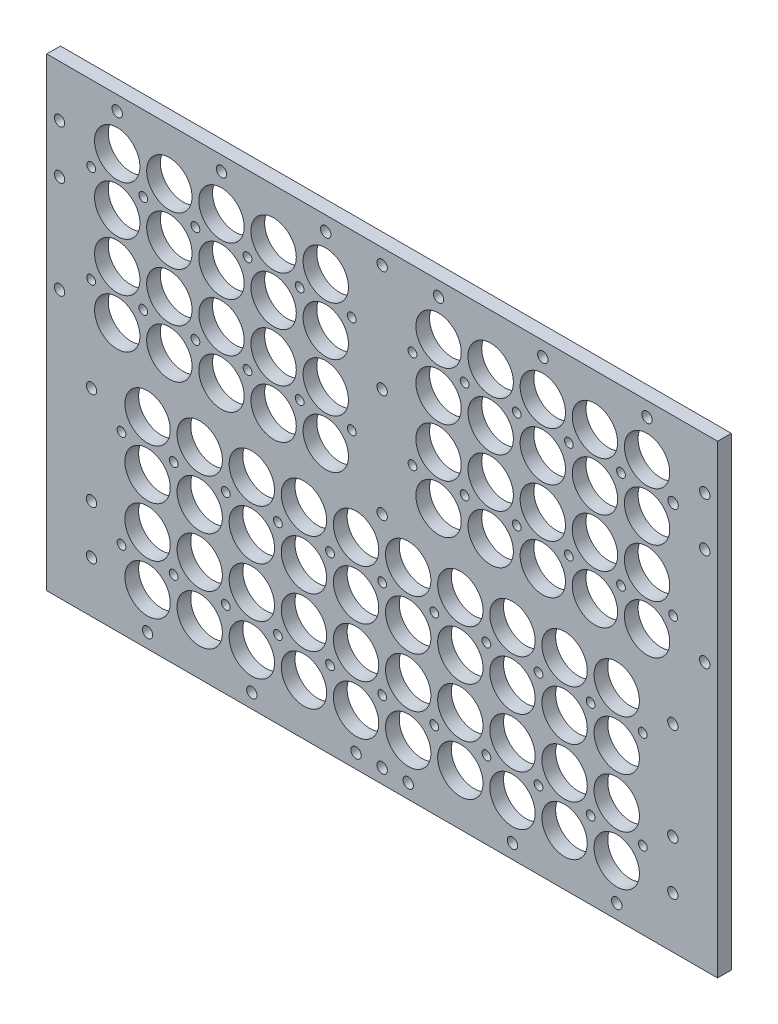
from build123d import *

# Parameters (mm, degrees)
SKETCH1_W            = 310.536510358
SKETCH1_H            = 215.178830534
SKETCH1_R            = 10.5
SKETCH1_R_2          = 10.499999955
SKETCH1_R_3          = 2.032
SKETCH1_R_4          = 1.47134792
SKETCH1_R_5          = 0.465963602
SKETCH1_R_6          = 1.12274205
SKETCH1_R_7          = 2.23196776
SKETCH1_R_8          = 1.6159218
SKETCH1_R_9          = 0.958347744
SKETCH1_R_10         = 1.565
BOSS_EXTRUDE1_DEPTH  = 6.35
M4_CLEARANCE_HOLE1_D = 4.8


with BuildPart() as part:
    # Sketch1 → Boss-Extrude1 (new body)
    with BuildSketch(Plane.XY):
        with Locations((108.585, 83.881415267)):
            Rectangle(SKETCH1_W, SKETCH1_H)
        Circle(SKETCH1_R, mode=Mode.SUBTRACT)
        with Locations((24.13, 0)):
            Circle(SKETCH1_R, mode=Mode.SUBTRACT)
        with Locations((0, 23.097612903)):
            Circle(SKETCH1_R, mode=Mode.SUBTRACT)
        with Locations((24.13, 23.097612903)):
            Circle(SKETCH1_R, mode=Mode.SUBTRACT)
        with Locations((0, 46.195225806)):
            Circle(SKETCH1_R, mode=Mode.SUBTRACT)
        with Locations((24.13, 46.195225806)):
            Circle(SKETCH1_R, mode=Mode.SUBTRACT)
        with Locations((0, 69.29283871)):
            Circle(SKETCH1_R, mode=Mode.SUBTRACT)
        with Locations((24.13, 69.29283871)):
            Circle(SKETCH1_R, mode=Mode.SUBTRACT)
        with Locations((48.26, 0)):
            Circle(SKETCH1_R, mode=Mode.SUBTRACT)
        with Locations((72.39, 0)):
            Circle(SKETCH1_R, mode=Mode.SUBTRACT)
        with Locations((96.52, 0)):
            Circle(SKETCH1_R, mode=Mode.SUBTRACT)
        with Locations((120.65, 0)):
            Circle(SKETCH1_R, mode=Mode.SUBTRACT)
        with Locations((144.78, 0)):
            Circle(SKETCH1_R, mode=Mode.SUBTRACT)
        with Locations((168.91, 0)):
            Circle(SKETCH1_R, mode=Mode.SUBTRACT)
        with Locations((193.04, 0)):
            Circle(SKETCH1_R, mode=Mode.SUBTRACT)
        with Locations((217.17, 0)):
            Circle(SKETCH1_R, mode=Mode.SUBTRACT)
        with Locations((48.26, 23.097612903)):
            Circle(SKETCH1_R, mode=Mode.SUBTRACT)
        with Locations((72.39, 23.097612903)):
            Circle(SKETCH1_R, mode=Mode.SUBTRACT)
        with Locations((96.52, 23.097612903)):
            Circle(SKETCH1_R, mode=Mode.SUBTRACT)
        with Locations((120.65, 23.097612903)):
            Circle(SKETCH1_R, mode=Mode.SUBTRACT)
        with Locations((144.78, 23.097612903)):
            Circle(SKETCH1_R, mode=Mode.SUBTRACT)
        with Locations((168.91, 23.097612903)):
            Circle(SKETCH1_R, mode=Mode.SUBTRACT)
        with Locations((193.04, 23.097612903)):
            Circle(SKETCH1_R, mode=Mode.SUBTRACT)
        with Locations((217.17, 23.097612903)):
            Circle(SKETCH1_R, mode=Mode.SUBTRACT)
        with Locations((48.26, 46.195225806)):
            Circle(SKETCH1_R, mode=Mode.SUBTRACT)
        with Locations((72.39, 46.195225806)):
            Circle(SKETCH1_R, mode=Mode.SUBTRACT)
        with Locations((96.52, 46.195225806)):
            Circle(SKETCH1_R, mode=Mode.SUBTRACT)
        with Locations((120.65, 46.195225806)):
            Circle(SKETCH1_R, mode=Mode.SUBTRACT)
        with Locations((144.78, 46.195225806)):
            Circle(SKETCH1_R, mode=Mode.SUBTRACT)
        with Locations((168.91, 46.195225806)):
            Circle(SKETCH1_R, mode=Mode.SUBTRACT)
        with Locations((193.04, 46.195225806)):
            Circle(SKETCH1_R, mode=Mode.SUBTRACT)
        with Locations((217.17, 46.195225806)):
            Circle(SKETCH1_R, mode=Mode.SUBTRACT)
        with Locations((48.26, 69.29283871)):
            Circle(SKETCH1_R, mode=Mode.SUBTRACT)
        with Locations((72.39, 69.29283871)):
            Circle(SKETCH1_R, mode=Mode.SUBTRACT)
        with Locations((96.52, 69.29283871)):
            Circle(SKETCH1_R, mode=Mode.SUBTRACT)
        with Locations((120.65, 69.29283871)):
            Circle(SKETCH1_R, mode=Mode.SUBTRACT)
        with Locations((144.78, 69.29283871)):
            Circle(SKETCH1_R, mode=Mode.SUBTRACT)
        with Locations((168.91, 69.29283871)):
            Circle(SKETCH1_R, mode=Mode.SUBTRACT)
        with Locations((193.04, 69.29283871)):
            Circle(SKETCH1_R, mode=Mode.SUBTRACT)
        with Locations((217.17, 69.29283871)):
            Circle(SKETCH1_R, mode=Mode.SUBTRACT)
        with Locations((82.474724757, 99.93502757)):
            Circle(SKETCH1_R_2, mode=Mode.SUBTRACT)
        with Locations((58.344724757, 99.93502757)):
            Circle(SKETCH1_R_2, mode=Mode.SUBTRACT)
        with Locations((34.214724757, 99.93502757)):
            Circle(SKETCH1_R_2, mode=Mode.SUBTRACT)
        with Locations((10.084724757, 99.93502757)):
            Circle(SKETCH1_R_2, mode=Mode.SUBTRACT)
        with Locations((-14.045275243, 99.93502757)):
            Circle(SKETCH1_R_2, mode=Mode.SUBTRACT)
        with Locations((58.344724757, 122.550830579)):
            Circle(SKETCH1_R_2, mode=Mode.SUBTRACT)
        with Locations((34.214724757, 122.550830579)):
            Circle(SKETCH1_R_2, mode=Mode.SUBTRACT)
        with Locations((10.084724757, 122.550830579)):
            Circle(SKETCH1_R_2, mode=Mode.SUBTRACT)
        with Locations((-14.045275243, 122.550830579)):
            Circle(SKETCH1_R_2, mode=Mode.SUBTRACT)
        with Locations((58.344724757, 145.166633588)):
            Circle(SKETCH1_R_2, mode=Mode.SUBTRACT)
        with Locations((34.214724757, 145.166633588)):
            Circle(SKETCH1_R_2, mode=Mode.SUBTRACT)
        with Locations((10.084724757, 145.166633588)):
            Circle(SKETCH1_R_2, mode=Mode.SUBTRACT)
        with Locations((-14.045275243, 145.166633588)):
            Circle(SKETCH1_R_2, mode=Mode.SUBTRACT)
        with Locations((58.344724757, 167.782436597)):
            Circle(SKETCH1_R_2, mode=Mode.SUBTRACT)
        with Locations((34.214724757, 167.782436597)):
            Circle(SKETCH1_R_2, mode=Mode.SUBTRACT)
        with Locations((10.084724757, 167.782436597)):
            Circle(SKETCH1_R_2, mode=Mode.SUBTRACT)
        with Locations((-14.045275243, 167.782436597)):
            Circle(SKETCH1_R_2, mode=Mode.SUBTRACT)
        with Locations((82.474724757, 122.550830579)):
            Circle(SKETCH1_R_2, mode=Mode.SUBTRACT)
        with Locations((82.474724757, 145.166633588)):
            Circle(SKETCH1_R_2, mode=Mode.SUBTRACT)
        with Locations((82.474724757, 167.782436597)):
            Circle(SKETCH1_R_2, mode=Mode.SUBTRACT)
        with Locations(Location((231.215275243, 99.93502757, 0), (0, 0, 180))):
            Circle(SKETCH1_R_2, mode=Mode.SUBTRACT)
        with Locations(Location((207.085275243, 99.93502757, 0), (0, 0, 180))):
            Circle(SKETCH1_R_2, mode=Mode.SUBTRACT)
        with Locations(Location((182.955275243, 99.93502757, 0), (0, 0, 180))):
            Circle(SKETCH1_R_2, mode=Mode.SUBTRACT)
        with Locations(Location((182.955275243, 122.550830579, 0), (0, 0, 180))):
            Circle(SKETCH1_R_2, mode=Mode.SUBTRACT)
        with Locations(Location((207.085275243, 122.550830579, 0), (0, 0, 180))):
            Circle(SKETCH1_R_2, mode=Mode.SUBTRACT)
        with Locations(Location((231.215275243, 122.550830579, 0), (0, 0, 180))):
            Circle(SKETCH1_R_2, mode=Mode.SUBTRACT)
        with Locations(Location((231.215275243, 145.166633588, 0), (0, 0, 180))):
            Circle(SKETCH1_R_2, mode=Mode.SUBTRACT)
        with Locations(Location((231.215275243, 167.782436597, 0), (0, 0, 180))):
            Circle(SKETCH1_R_2, mode=Mode.SUBTRACT)
        with Locations(Location((207.085275243, 167.782436597, 0), (0, 0, 180))):
            Circle(SKETCH1_R_2, mode=Mode.SUBTRACT)
        with Locations(Location((207.085275243, 145.166633588, 0), (0, 0, 180))):
            Circle(SKETCH1_R_2, mode=Mode.SUBTRACT)
        with Locations(Location((182.955275243, 145.166633588, 0), (0, 0, 180))):
            Circle(SKETCH1_R_2, mode=Mode.SUBTRACT)
        with Locations(Location((182.955275243, 167.782436597, 0), (0, 0, 180))):
            Circle(SKETCH1_R_2, mode=Mode.SUBTRACT)
        with Locations(Location((158.825275243, 167.782436597, 0), (0, 0, 180))):
            Circle(SKETCH1_R_2, mode=Mode.SUBTRACT)
        with Locations(Location((158.825275243, 145.166633588, 0), (0, 0, 180))):
            Circle(SKETCH1_R_2, mode=Mode.SUBTRACT)
        with Locations(Location((158.825275243, 122.550830579, 0), (0, 0, 180))):
            Circle(SKETCH1_R_2, mode=Mode.SUBTRACT)
        with Locations(Location((158.825275243, 99.93502757, 0), (0, 0, 180))):
            Circle(SKETCH1_R_2, mode=Mode.SUBTRACT)
        with Locations(Location((134.695275243, 99.93502757, 0), (0, 0, 180))):
            Circle(SKETCH1_R_2, mode=Mode.SUBTRACT)
        with Locations(Location((134.695275243, 122.550830579, 0), (0, 0, 180))):
            Circle(SKETCH1_R_2, mode=Mode.SUBTRACT)
        with Locations(Location((134.695275243, 145.166633588, 0), (0, 0, 180))):
            Circle(SKETCH1_R_2, mode=Mode.SUBTRACT)
        with Locations(Location((134.695275243, 167.782436597, 0), (0, 0, 180))):
            Circle(SKETCH1_R_2, mode=Mode.SUBTRACT)
        with Locations((12.065, 12.065)):
            Circle(SKETCH1_R_3, mode=Mode.SUBTRACT)
        with Locations((36.195, 12.065)):
            Circle(SKETCH1_R_3, mode=Mode.SUBTRACT)
        with Locations((60.325, 12.065)):
            Circle(SKETCH1_R_3, mode=Mode.SUBTRACT)
        with Locations((84.455, 12.065)):
            Circle(SKETCH1_R_3, mode=Mode.SUBTRACT)
        with Locations((108.585, 12.065)):
            Circle(SKETCH1_R_3, mode=Mode.SUBTRACT)
        with Locations((132.715, 12.065)):
            Circle(SKETCH1_R_3, mode=Mode.SUBTRACT)
        with Locations((156.845, 12.065)):
            Circle(SKETCH1_R_3, mode=Mode.SUBTRACT)
        with Locations((180.975, 12.065)):
            Circle(SKETCH1_R_3, mode=Mode.SUBTRACT)
        with Locations((205.105, 12.065)):
            Circle(SKETCH1_R_3, mode=Mode.SUBTRACT)
        with Locations((229.235, 12.065)):
            Circle(SKETCH1_R_3, mode=Mode.SUBTRACT)
        with Locations((36.195, 57.277)):
            Circle(SKETCH1_R_3, mode=Mode.SUBTRACT)
        with Locations((60.325, 57.277)):
            Circle(SKETCH1_R_3, mode=Mode.SUBTRACT)
        with Locations((84.455, 57.277)):
            Circle(SKETCH1_R_3, mode=Mode.SUBTRACT)
        with Locations((108.585, 57.277)):
            Circle(SKETCH1_R_3, mode=Mode.SUBTRACT)
        with Locations((132.715, 57.277)):
            Circle(SKETCH1_R_3, mode=Mode.SUBTRACT)
        with Locations((156.845, 57.277)):
            Circle(SKETCH1_R_3, mode=Mode.SUBTRACT)
        with Locations((180.975, 57.277)):
            Circle(SKETCH1_R_3, mode=Mode.SUBTRACT)
        with Locations((205.105, 57.277)):
            Circle(SKETCH1_R_3, mode=Mode.SUBTRACT)
        with Locations((229.235, 57.277)):
            Circle(SKETCH1_R_3, mode=Mode.SUBTRACT)
        with Locations((12.065, 57.277)):
            Circle(SKETCH1_R_3, mode=Mode.SUBTRACT)
        with Locations((-12.065, 57.277)):
            Circle(SKETCH1_R_3, mode=Mode.SUBTRACT)
        with Locations((-12.065, 12.065)):
            Circle(SKETCH1_R_3, mode=Mode.SUBTRACT)
        with Locations((-1.980275243, 111.247830579)):
            Circle(SKETCH1_R_3, mode=Mode.SUBTRACT)
        with Locations((22.149724757, 111.247830579)):
            Circle(SKETCH1_R_3, mode=Mode.SUBTRACT)
        with Locations((46.279724757, 111.247830579)):
            Circle(SKETCH1_R_3, mode=Mode.SUBTRACT)
        with Locations((70.409724757, 111.247830579)):
            Circle(SKETCH1_R_3, mode=Mode.SUBTRACT)
        with Locations((94.539724757, 111.247830579)):
            Circle(SKETCH1_R_3, mode=Mode.SUBTRACT)
        with Locations((22.149724757, 156.459830579)):
            Circle(SKETCH1_R_3, mode=Mode.SUBTRACT)
        with Locations((46.279724757, 156.459830579)):
            Circle(SKETCH1_R_3, mode=Mode.SUBTRACT)
        with Locations((70.409724757, 156.459830579)):
            Circle(SKETCH1_R_3, mode=Mode.SUBTRACT)
        with Locations((94.539724757, 156.459830579)):
            Circle(SKETCH1_R_3, mode=Mode.SUBTRACT)
        with Locations((-1.980275243, 156.459830579)):
            Circle(SKETCH1_R_3, mode=Mode.SUBTRACT)
        with Locations((-26.110275243, 111.247830579)):
            Circle(SKETCH1_R_3, mode=Mode.SUBTRACT)
        with Locations((-26.110275243, 156.459830579)):
            Circle(SKETCH1_R_3, mode=Mode.SUBTRACT)
        with Locations(Location((122.630275243, 156.459830579, 0), (0, 0, 180))):
            Circle(SKETCH1_R_3, mode=Mode.SUBTRACT)
        with Locations(Location((122.630275243, 111.247830579, 0), (0, 0, 180))):
            Circle(SKETCH1_R_3, mode=Mode.SUBTRACT)
        with Locations(Location((146.760275243, 111.247830579, 0), (0, 0, 180))):
            Circle(SKETCH1_R_3, mode=Mode.SUBTRACT)
        with Locations(Location((146.760275243, 156.459830579, 0), (0, 0, 180))):
            Circle(SKETCH1_R_3, mode=Mode.SUBTRACT)
        with Locations(Location((170.890275243, 156.459830579, 0), (0, 0, 180))):
            Circle(SKETCH1_R_3, mode=Mode.SUBTRACT)
        with Locations(Location((170.890275243, 111.247830579, 0), (0, 0, 180))):
            Circle(SKETCH1_R_3, mode=Mode.SUBTRACT)
        with Locations(Location((195.020275243, 111.247830579, 0), (0, 0, 180))):
            Circle(SKETCH1_R_3, mode=Mode.SUBTRACT)
        with Locations(Location((195.020275243, 156.459830579, 0), (0, 0, 180))):
            Circle(SKETCH1_R_3, mode=Mode.SUBTRACT)
        with Locations(Location((219.150275243, 156.459830579, 0), (0, 0, 180))):
            Circle(SKETCH1_R_3, mode=Mode.SUBTRACT)
        with Locations(Location((219.150275243, 111.247830579, 0), (0, 0, 180))):
            Circle(SKETCH1_R_3, mode=Mode.SUBTRACT)
        with Locations(Location((243.280275243, 111.247830579, 0), (0, 0, 180))):
            Circle(SKETCH1_R_3, mode=Mode.SUBTRACT)
        with Locations(Location((243.280275243, 156.459830579, 0), (0, 0, 180))):
            Circle(SKETCH1_R_3, mode=Mode.SUBTRACT)
        with Locations((-40.744735179, 99.93502757)):
            Circle(SKETCH1_R_4, mode=Mode.SUBTRACT)
        with Locations((-25.959701446, 0)):
            Circle(SKETCH1_R_5, mode=Mode.SUBTRACT)
        with Locations((-25.959701446, 22.606)):
            Circle(SKETCH1_R_5, mode=Mode.SUBTRACT)
        with Locations((-25.959701446, 67.818)):
            Circle(SKETCH1_R_5, mode=Mode.SUBTRACT)
        with Locations((-40.744735179, 145.14702757)):
            Circle(SKETCH1_R_4, mode=Mode.SUBTRACT)
        with Locations((-40.744735179, 167.75302757)):
            Circle(SKETCH1_R_4, mode=Mode.SUBTRACT)
        with Locations((0, -17.030241448)):
            Circle(SKETCH1_R_6, mode=Mode.SUBTRACT)
        with Locations((48.26, -17.030241448)):
            Circle(SKETCH1_R_6, mode=Mode.SUBTRACT)
        with Locations((96.52, -17.030241448)):
            Circle(SKETCH1_R_6, mode=Mode.SUBTRACT)
        with Locations((120.65, -17.030241448)):
            Circle(SKETCH1_R_6, mode=Mode.SUBTRACT)
        with Locations((168.91, -17.030241448)):
            Circle(SKETCH1_R_6, mode=Mode.SUBTRACT)
        with Locations((217.17, -17.030241448)):
            Circle(SKETCH1_R_6, mode=Mode.SUBTRACT)
        with Locations(Location((257.914735179, 167.75302757, 0), (0, 0, 180))):
            Circle(SKETCH1_R_4, mode=Mode.SUBTRACT)
        with Locations(Location((257.914735179, 145.14702757, 0), (0, 0, 180))):
            Circle(SKETCH1_R_4, mode=Mode.SUBTRACT)
        with Locations(Location((257.914735179, 99.93502757, 0), (0, 0, 180))):
            Circle(SKETCH1_R_4, mode=Mode.SUBTRACT)
        with Locations(Location((243.129701446, 67.818, 0), (0, 0, 180))):
            Circle(SKETCH1_R_5, mode=Mode.SUBTRACT)
        with Locations(Location((243.129701446, 22.606, 0), (0, 0, 180))):
            Circle(SKETCH1_R_5, mode=Mode.SUBTRACT)
        with Locations(Location((243.129701446, 0, 0), (0, 0, 180))):
            Circle(SKETCH1_R_5, mode=Mode.SUBTRACT)
        with Locations((-14.045275243, 184.793071982)):
            Circle(SKETCH1_R_7, mode=Mode.SUBTRACT)
        with Locations((34.214724757, 184.793071982)):
            Circle(SKETCH1_R_7, mode=Mode.SUBTRACT)
        with Locations((82.474724757, 184.793071982)):
            Circle(SKETCH1_R_7, mode=Mode.SUBTRACT)
        with Locations(Location((134.695275243, 184.793071982, 0), (0, 0, 180))):
            Circle(SKETCH1_R_7, mode=Mode.SUBTRACT)
        with Locations(Location((182.955275243, 184.793071982, 0), (0, 0, 180))):
            Circle(SKETCH1_R_7, mode=Mode.SUBTRACT)
        with Locations(Location((231.215275243, 184.793071982, 0), (0, 0, 180))):
            Circle(SKETCH1_R_7, mode=Mode.SUBTRACT)
        with Locations((108.585, 184.390606749)):
            Circle(SKETCH1_R_8, mode=Mode.SUBTRACT)
        with Locations((108.585, 134.656830624)):
            Circle(SKETCH1_R_9, mode=Mode.SUBTRACT)
        with Locations((108.585, 84.618830624)):
            Circle(SKETCH1_R_10, mode=Mode.SUBTRACT)
        with Locations((108.585, -17.030241448)):
            Circle(SKETCH1_R_10, mode=Mode.SUBTRACT)
    extrude(amount=BOSS_EXTRUDE1_DEPTH)

    # M4 Clearance Hole1 (through all)
    with Locations(Plane.XY.offset(6.35)):
        with Locations((0, -17.030241448), (-25.959701446, 0), (-25.959701446, 22.606), (-25.959701446, 67.818), (-40.744735179, 99.93502757), (-40.744735179, 145.14702757), (-40.744735179, 167.75302757), (-14.045275243, 184.793071982), (34.214724757, 184.793071982), (82.474724757, 184.793071982), (108.585, 184.390606749), (134.695275243, 184.793071982), (182.955275243, 184.793071982), (231.215275243, 184.793071982), (257.914735179, 167.75302757), (243.280275243, 156.459830579), (257.914735179, 145.14702757), (257.914735179, 99.93502757), (243.129701446, 67.818), (243.129701446, 22.606), (243.129701446, 0), (217.17, -17.030241448), (168.91, -17.030241448), (120.65, -17.030241448), (108.585, -17.030241448), (96.52, -17.030241448), (48.26, -17.030241448), (108.585, 84.618830624), (108.585, 134.656830624)):
            Hole(M4_CLEARANCE_HOLE1_D / 2)


solid = part.part
